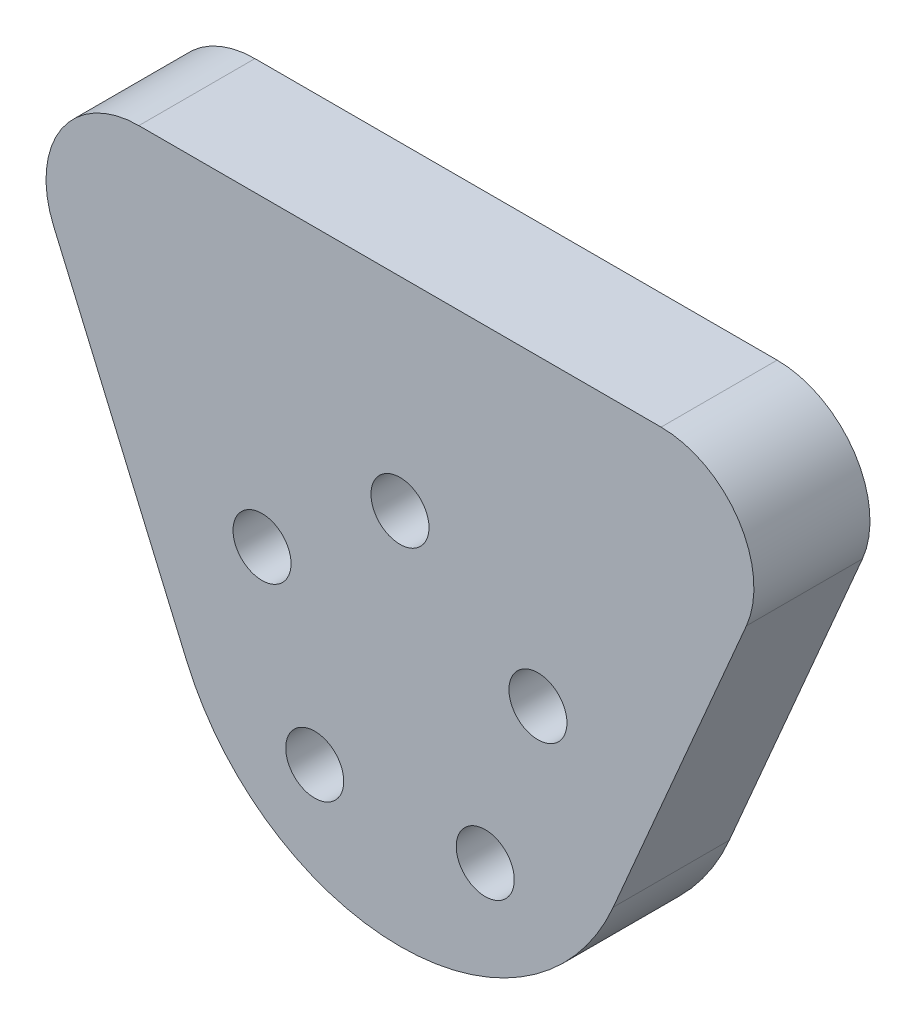
from build123d import *

# Parameters (mm, degrees)
CROQUIS1_R              = 2.5
SALIENTE_EXTRUIR1_DEPTH = 10


with BuildPart() as part:
    # Croquis1 → Saliente-Extruir1 (new body)
    with BuildSketch(Plane.XY):
        with BuildLine():
            Line((-45, 8), (0, 8))
            ThreePointArc((0, 8), (6.679829127, 4.402258834), (7.351584195, -3.15502929))
            Line((7.351584195, -3.15502929), (-4.121039512, -29.887573226))
            ThreePointArc((-4.121039512, -29.887573226), (-22.5, -42), (-40.878960488, -29.887573226))
            Line((-40.878960488, -29.887573226), (-52.351584195, -3.15502929))
            ThreePointArc((-52.351584195, -3.15502929), (-51.679829127, 4.402258834), (-45, 8))
        make_face()
        with Locations((-22.5, -9.5)):
            Circle(CROQUIS1_R, mode=Mode.SUBTRACT)
        with Locations((-10.611793546, -18.13728757)):
            Circle(CROQUIS1_R, mode=Mode.SUBTRACT)
        with Locations((-15.152684346, -32.11271243)):
            Circle(CROQUIS1_R, mode=Mode.SUBTRACT)
        with Locations((-29.847315654, -32.11271243)):
            Circle(CROQUIS1_R, mode=Mode.SUBTRACT)
        with Locations((-34.388206454, -18.13728757)):
            Circle(CROQUIS1_R, mode=Mode.SUBTRACT)
    extrude(amount=SALIENTE_EXTRUIR1_DEPTH)


solid = part.part
